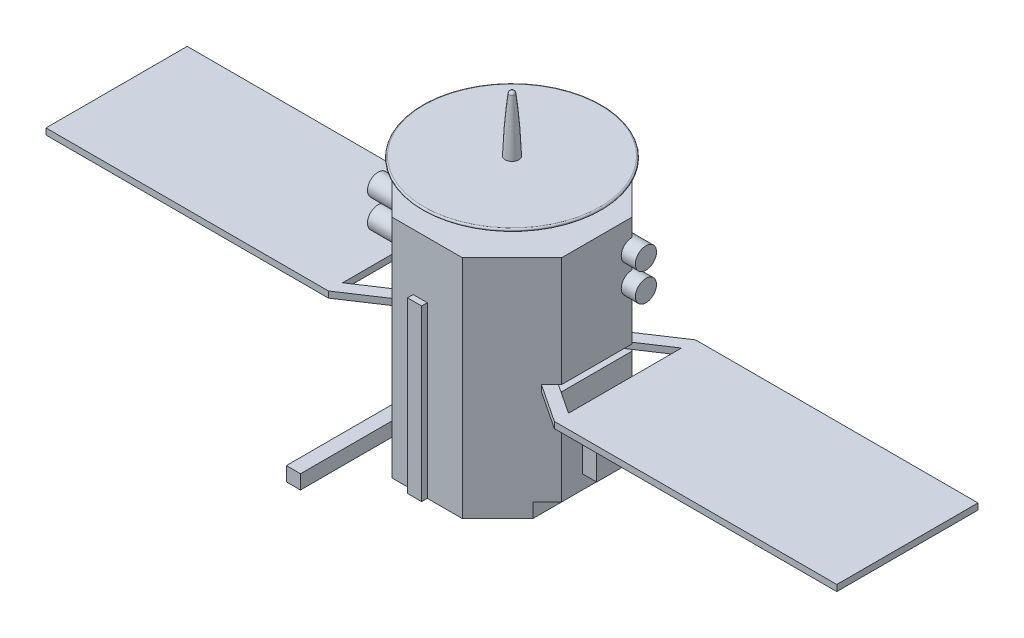
from build123d import *

# Parameters (mm, degrees)
BOSS_EXTRUDE1_DEPTH      = 80
CUT_EXTRUDE1_DEPTH       = 1.1
SKETCH5_R                = 5.1
CUT_EXTRUDE3_DEPTH       = 12
BOSS_EXTRUDE2_START      = -12
SKETCH6_R                = 3.75
SKETCH6_W                = 10
SKETCH6_H                = 10
BOSS_EXTRUDE2_DEPTH      = 17
SKETCH7_W                = 5
SKETCH7_H                = 60
BOSS_EXTRUDE3_DEPTH      = 2
SKETCH8_W                = 5.1
SKETCH8_H                = 5.1
CUT_EXTRUDE4_DEPTH       = 106.948100502
BOSS_EXTRUDE4_DEPTH      = 2.2
CIRPATTERN1_COUNT        = 2
FILLET1_R                = 0.5
BOSS_EXTRUDE5_DEPTH      = 50
BOSS_EXTRUDE5_DEPTH_BACK = 50
SKETCH11_W               = 5
SKETCH11_H               = 5


with BuildPart() as part:
    # Sketch1 → Boss-Extrude1 (new body)
    with BuildSketch(Plane(origin=(0, 0, 0), x_dir=(1, 0, 0), z_dir=(0, 1, 0))):
        Polygon((12.426406871, -30), (30, -12.426406871), (30, 12.426406871), (12.426406871, 30), (-12.426406871, 30), (-30, 12.426406871), (-30, -12.426406871), (-12.426406871, -30), align=None)
    extrude(amount=BOSS_EXTRUDE1_DEPTH)

    # Sketch3 → Cut-Extrude1 (cut, symmetric)
    with BuildSketch(Plane(origin=(0, 40, 0), x_dir=(1, 0, 0), z_dir=(0, 1, 0))):
        Polygon((40, 25), (10, 5.1), (10, -5.1), (40, -25), align=None)
    cut_extrude1 = extrude(amount=CUT_EXTRUDE1_DEPTH, both=True, mode=Mode.SUBTRACT)

    # Mirror1: Cut-Extrude1 across plane
    add(cut_extrude1.mirror(Plane(origin=(0, 0, 0), x_dir=(0, 0, 1), z_dir=(1, 0, 0))), mode=Mode.SUBTRACT)

    # Sketch5 → Cut-Extrude3 (cut)
    with BuildSketch(Plane(origin=(0, 80, 0), x_dir=(1, 0, 0), z_dir=(0, 1, 0))):
        with Locations(Location((0, 0, 0), (0, 0, 270))):
            Circle(SKETCH5_R)
    extrude(amount=-CUT_EXTRUDE3_DEPTH, mode=Mode.SUBTRACT)

    # Sketch6 → Boss-Extrude2 (add)
    with BuildSketch(Plane.ZY.offset(30).offset(BOSS_EXTRUDE2_START)):
        with Locations((12.426406871, 70)):
            Circle(SKETCH6_R)
        with Locations((12.426406871, 60)):
            Circle(SKETCH6_R)
        with Locations((0, 15)):
            Rectangle(SKETCH6_W, SKETCH6_H)
    boss_extrude2 = extrude(amount=BOSS_EXTRUDE2_DEPTH)

    # Sketch7 → Boss-Extrude3 (add)
    with BuildSketch(Plane.XY.offset(30)):
        with Locations((-2.5, 30)):
            Rectangle(SKETCH7_W, SKETCH7_H)
    boss_extrude3 = extrude(amount=BOSS_EXTRUDE3_DEPTH)

    # Sketch8 → Cut-Extrude4 (cut, through all)
    with BuildSketch(Plane.XY.offset(30)):
        with Locations((-27.45, 2.55)):
            Rectangle(SKETCH8_W, SKETCH8_H)
    cut_extrude4 = extrude(amount=-CUT_EXTRUDE4_DEPTH, mode=Mode.SUBTRACT)

    # Sketch9 → Boss-Extrude4 (add)
    # profile 1 of 2: a face of its own
    with BuildSketch(Plane(origin=(0, 38.9, 0), x_dir=(1, 0, 0), z_dir=(0, 1, 0))):
        Polygon((-10, -5.1), (-10, 5.1), (-40, 25), (-140, 25), (-140, -25), (-40, -25), align=None)
        Polygon((-40, 20), (-40, -20), (-15, -3.416666667), (-15, 3.416666667), align=None, mode=Mode.SUBTRACT)
    # profile 2 of 2: a face of its own
    with BuildSketch(Plane(origin=(0, 38.9, 0), x_dir=(1, 0, 0), z_dir=(0, 1, 0))):
        Polygon((140, -25), (40, -25), (10, -5.1), (10, 5.1), (40, 25), (140, 25), align=None)
        Polygon((15, 3.416666667), (40, 20), (40, -20), (15, -3.416666667), align=None, mode=Mode.SUBTRACT)
    extrude(amount=BOSS_EXTRUDE4_DEPTH)

    # CirPattern1: Boss-Extrude2, Boss-Extrude3, Cut-Extrude4 ×2 about axis
    cirpattern1_axis = Axis((0, 0, 0), (0, 1, 0))
    add([boss_extrude2.rotate(cirpattern1_axis, i * 360 / CIRPATTERN1_COUNT) for i in range(1, CIRPATTERN1_COUNT)])
    add([boss_extrude3.rotate(cirpattern1_axis, i * 360 / CIRPATTERN1_COUNT) for i in range(1, CIRPATTERN1_COUNT)])
    add([cut_extrude4.rotate(cirpattern1_axis, i * 360 / CIRPATTERN1_COUNT) for i in range(1, CIRPATTERN1_COUNT)], mode=Mode.SUBTRACT)

    # Sketch10 → Revolve2 (revolve)
    with BuildSketch(Plane.XY, mode=Mode.PRIVATE) as revolve2_sk:
        with BuildLine():
            Line((32.723066645, 90), (2.393066645, 90))
            ThreePointArc((2.393066645, 90), (1.895667326, 99.631968124), (0.993425901, 109.234476985))
            ThreePointArc((0.993425901, 109.234476985), (0.665403267, 109.866484087), (0, 110.12))
            Line((0, 110.12), (0, 68))
            Line((0, 68), (5.1, 68))
            Line((5.1, 68), (5.1, 80))
            ThreePointArc((5.1, 80), (19.662538377, 82.925493733), (32.723066645, 90))
        make_face()
    revolve(revolve2_sk.sketch.rotate(Axis((0, 68, 0), (0, 1, 0)), 90), axis=Axis((0, 68, 0), (0, 1, 0)))

    # Fillet1
    fillet1_edges = [part.edges().sort_by_distance(p)[0] for p in [
        (0, 90, 32.723066645),
    ]]
    fillet(fillet1_edges, radius=FILLET1_R)

    # Sketch11 → Boss-Extrude5 (add, two sides: drawn at the far end of the back side and taken through both)
    with BuildSketch(Plane.XY.offset(-BOSS_EXTRUDE5_DEPTH_BACK)):
        with Locations((-27.4, 2.6)):
            Rectangle(SKETCH11_W, SKETCH11_H)
    extrude(amount=BOSS_EXTRUDE5_DEPTH + BOSS_EXTRUDE5_DEPTH_BACK)


solid = part.part
